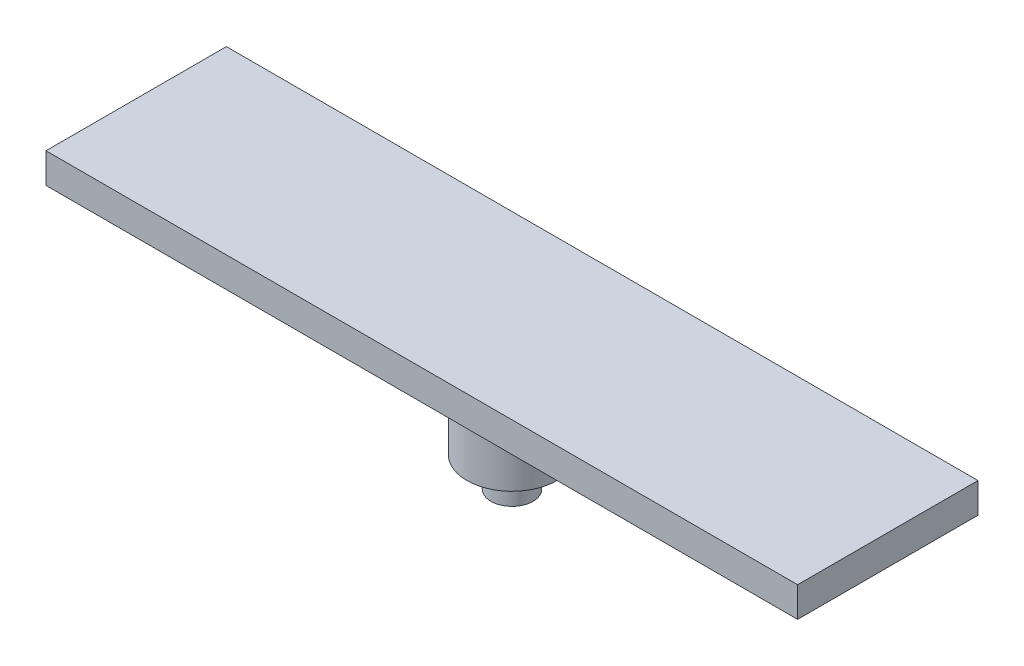
from build123d import *

# Parameters (mm, degrees)
SKETCH1_R           = 7.5
BOSS_EXTRUDE1_DEPTH = 15
SKETCH2_W           = 125
SKETCH2_H           = 30
BOSS_EXTRUDE2_DEPTH = 5
SKETCH3_R           = 3.5
BOSS_EXTRUDE3_DEPTH = 5


with BuildPart() as part:
    # Sketch1 → Boss-Extrude1 (new body)
    with BuildSketch(Plane(origin=(0, 0, 0), x_dir=(1, 0, 0), z_dir=(0, 1, 0))):
        with Locations(Location((0, 0, 0), (0, 0, 270))):
            Circle(SKETCH1_R)
    extrude(amount=BOSS_EXTRUDE1_DEPTH)

    # Sketch2 → Boss-Extrude2 (add)
    with BuildSketch(Plane(origin=(0, 15, 0), x_dir=(1, 0, 0), z_dir=(0, 1, 0))):
        Rectangle(SKETCH2_W, SKETCH2_H)
    extrude(amount=BOSS_EXTRUDE2_DEPTH)

    # Sketch3 → Boss-Extrude3 (add)
    with BuildSketch(Plane.XZ):
        with Locations(Location((0, 0, 0), (0, 0, 270))):
            Circle(SKETCH3_R)
    extrude(amount=BOSS_EXTRUDE3_DEPTH)


solid = part.part
